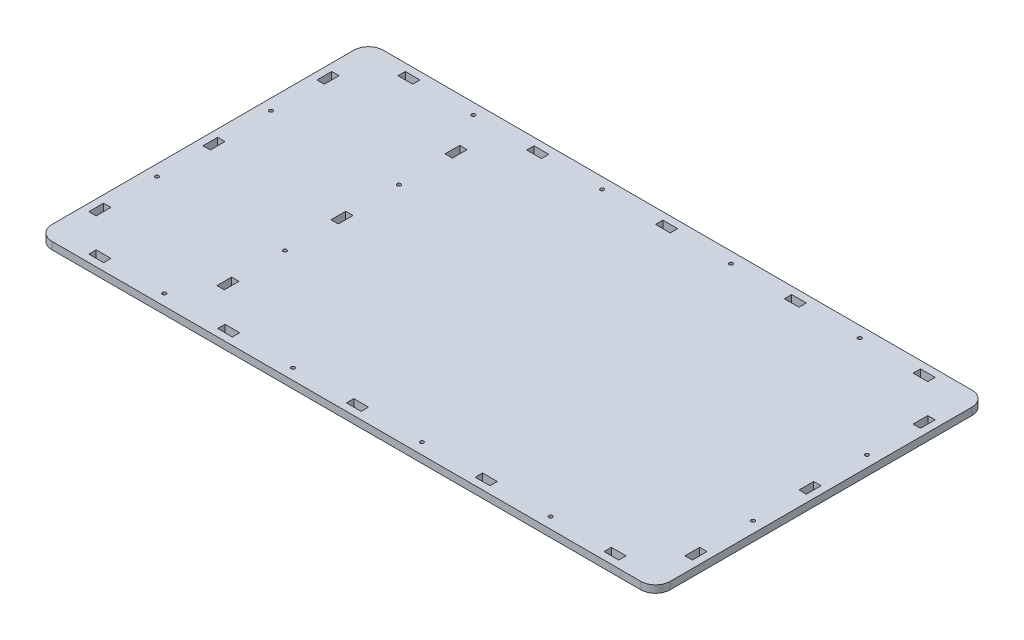
from build123d import *

# Parameters (mm, degrees)
SKETCH1_W           = 420
SKETCH1_H           = 225
BOSS_EXTRUDE1_DEPTH = 5
SKETCH2_W           = 5
SKETCH2_H           = 10
SKETCH2_W_2         = 10
SKETCH2_H_2         = 5
CUT_EXTRUDE1_DEPTH  = 239.288165883
FILLET1_R           = 10
SKETCH3_R           = 1.25
CUT_EXTRUDE2_DEPTH  = 239.288165883


with BuildPart() as part:
    # Sketch1 → Boss-Extrude1 (new body)
    with BuildSketch(Plane(origin=(0, 0, 0), x_dir=(1, 0, 0), z_dir=(0, 1, 0))):
        Rectangle(SKETCH1_W, SKETCH1_H)
    extrude(amount=BOSS_EXTRUDE1_DEPTH)

    # Sketch2 → Cut-Extrude1 (cut, through all)
    with BuildSketch(Plane(origin=(0, 5, 0), x_dir=(1, 0, 0), z_dir=(0, 1, 0))):
        with Locations((202.5, -77.5)):
            Rectangle(SKETCH2_W, SKETCH2_H)
        with Locations((-87.5, 105)):
            Rectangle(SKETCH2_W_2, SKETCH2_H_2)
        with Locations((-175, 105)):
            Rectangle(SKETCH2_W_2, SKETCH2_H_2)
        with Locations((-202.5, 77.5)):
            Rectangle(SKETCH2_W, SKETCH2_H)
        with Locations((0, 105)):
            Rectangle(SKETCH2_W_2, SKETCH2_H_2)
        with Locations((87.5, 105)):
            Rectangle(SKETCH2_W_2, SKETCH2_H_2)
        with Locations((175, 105)):
            Rectangle(SKETCH2_W_2, SKETCH2_H_2)
        with Locations((-202.5, 0)):
            Rectangle(SKETCH2_W, SKETCH2_H)
        with Locations((-202.5, -77.5)):
            Rectangle(SKETCH2_W, SKETCH2_H)
        with Locations((202.5, 0)):
            Rectangle(SKETCH2_W, SKETCH2_H)
        with Locations((202.5, 77.5)):
            Rectangle(SKETCH2_W, SKETCH2_H)
        with Locations((175, -105)):
            Rectangle(SKETCH2_W_2, SKETCH2_H_2)
        with Locations((87.5, -105)):
            Rectangle(SKETCH2_W_2, SKETCH2_H_2)
        with Locations((0, -105)):
            Rectangle(SKETCH2_W_2, SKETCH2_H_2)
        with Locations((-87.5, -105)):
            Rectangle(SKETCH2_W_2, SKETCH2_H_2)
        with Locations((-175, -105)):
            Rectangle(SKETCH2_W_2, SKETCH2_H_2)
        with Locations((-115.5, 77.5)):
            Rectangle(SKETCH2_W, SKETCH2_H)
        with Locations((-115.5, -77.5)):
            Rectangle(SKETCH2_W, SKETCH2_H)
        with Locations((-115.5, 0)):
            Rectangle(SKETCH2_W, SKETCH2_H)
    extrude(amount=-CUT_EXTRUDE1_DEPTH, mode=Mode.SUBTRACT)

    # Fillet1
    fillet1_edges = [part.edges().sort_by_distance(p)[0] for p in [
        (210, 2.5, 112.5),
        (-210, 2.5, 112.5),
        (-210, 2.5, -112.5),
        (210, 2.5, -112.5),
    ]]
    fillet(fillet1_edges, radius=FILLET1_R)

    # Sketch3 → Cut-Extrude2 (cut, through all)
    with BuildSketch(Plane(origin=(0, 5, 0), x_dir=(1, 0, 0), z_dir=(0, 1, 0))):
        with Locations(Location((-131.25, 105, 0), (0, 0, 270))):
            Circle(SKETCH3_R)
        with Locations(Location((-202.5, 38.75, 0), (0, 0, 270))):
            Circle(SKETCH3_R)
        with Locations(Location((-202.5, -38.75, 0), (0, 0, 270))):
            Circle(SKETCH3_R)
        with Locations(Location((-43.75, 105, 0), (0, 0, 270))):
            Circle(SKETCH3_R)
        with Locations(Location((43.75, 105, 0), (0, 0, 270))):
            Circle(SKETCH3_R)
        with Locations(Location((131.25, 105, 0), (0, 0, 270))):
            Circle(SKETCH3_R)
        with Locations(Location((-115.5, -38.75, 0), (0, 0, 90))):
            Circle(SKETCH3_R)
        with Locations(Location((-115.5, 38.75, 0), (0, 0, 90))):
            Circle(SKETCH3_R)
        with Locations(Location((202.5, -38.75, 0), (0, 0, 90))):
            Circle(SKETCH3_R)
        with Locations(Location((202.5, 38.75, 0), (0, 0, 90))):
            Circle(SKETCH3_R)
        with Locations(Location((131.25, -105, 0), (0, 0, 90))):
            Circle(SKETCH3_R)
        with Locations(Location((43.75, -105, 0), (0, 0, 90))):
            Circle(SKETCH3_R)
        with Locations(Location((-43.75, -105, 0), (0, 0, 90))):
            Circle(SKETCH3_R)
        with Locations(Location((-131.25, -105, 0), (0, 0, 90))):
            Circle(SKETCH3_R)
    extrude(amount=-CUT_EXTRUDE2_DEPTH, mode=Mode.SUBTRACT)


solid = part.part
